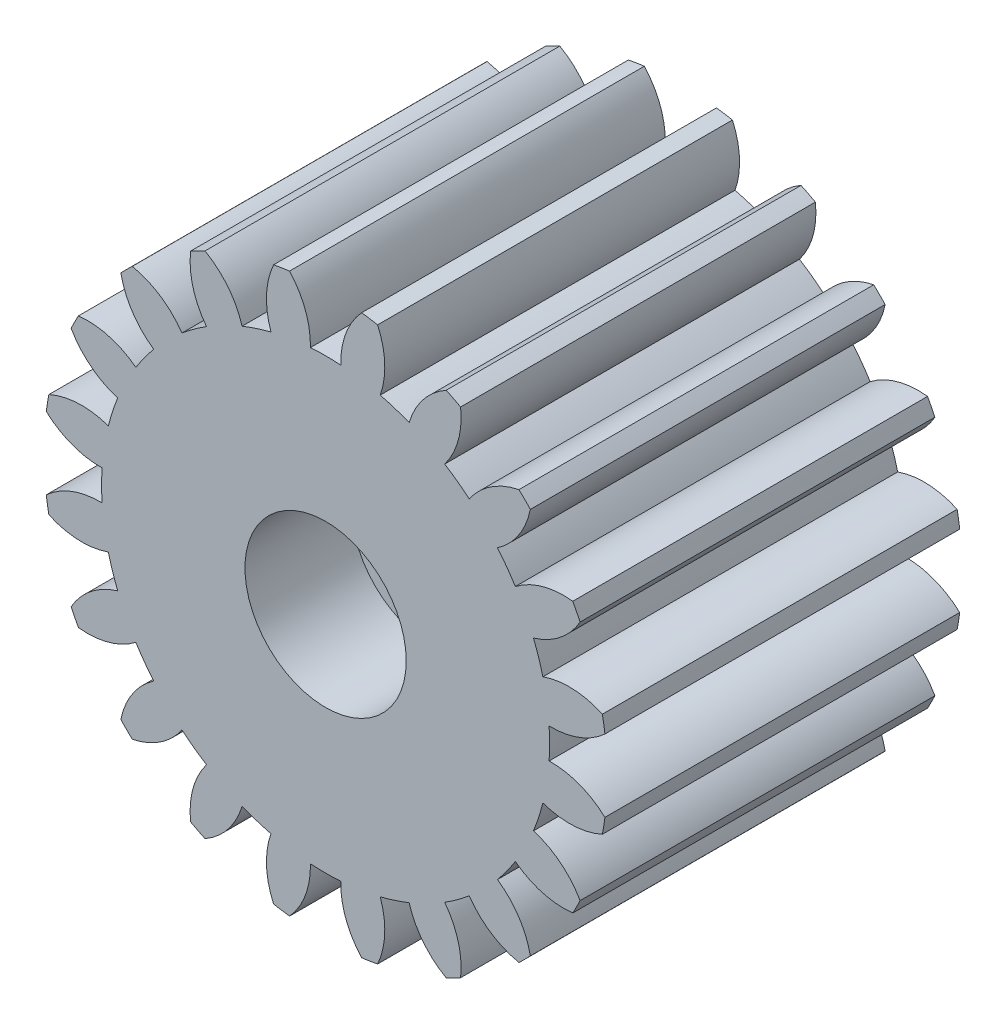
from build123d import *

# Parameters (mm, degrees)
SKETCH1_R           = 8.73125
BOSS_EXTRUDE1_DEPTH = 11
CUT_EXTRUDE1_DEPTH  = 17.536911838
CIRPATTERN1_COUNT   = 20
SKETCH4_R           = 2.5
CUT_EXTRUDE2_DEPTH  = 3.3
SKETCH5_R           = 1
CUT_EXTRUDE3_DEPTH  = 15.465788277


with BuildPart() as part:
    # Sketch1 → Boss-Extrude1 (new body)
    with BuildSketch(Plane.XY):
        Circle(SKETCH1_R)
    extrude(amount=BOSS_EXTRUDE1_DEPTH)

    # Sketch2 → Cut-Extrude1 (cut, through all)
    with BuildSketch(Plane.XY.offset(11)):
        with BuildLine():
            Line((9.170880897, -1.77931535), (9.170880897, 1.77931535))
            ThreePointArc((9.170880897, 1.77931535), (8.236219229, 0.806271061), (6.929309614, 0.4710176))
            ThreePointArc((6.929309614, 0.4710176), (6.9452998, 0), (6.929309614, -0.4710176))
            ThreePointArc((6.929309614, -0.4710176), (8.236219229, -0.806271061), (9.170880897, -1.77931535))
        make_face()
    cut_extrude1 = extrude(amount=-CUT_EXTRUDE1_DEPTH, mode=Mode.SUBTRACT)

    # CirPattern1: Cut-Extrude1 ×20 about axis
    cirpattern1_axis = Axis((0, 0, 0), (0, 0, 1))
    for i in range(1, CIRPATTERN1_COUNT):
        add(cut_extrude1.rotate(cirpattern1_axis, i * 360 / CIRPATTERN1_COUNT), mode=Mode.SUBTRACT)

    # Sketch4 → Cut-Extrude2 (cut)
    with BuildSketch(Plane.XY.offset(11)):
        Circle(SKETCH4_R)
    extrude(amount=-CUT_EXTRUDE2_DEPTH, mode=Mode.SUBTRACT)

    # Sketch5 → Cut-Extrude3 (cut, through all)
    with BuildSketch(Plane.XY.offset(7.7)):
        Circle(SKETCH5_R)
    extrude(amount=-CUT_EXTRUDE3_DEPTH, mode=Mode.SUBTRACT)


solid = part.part
